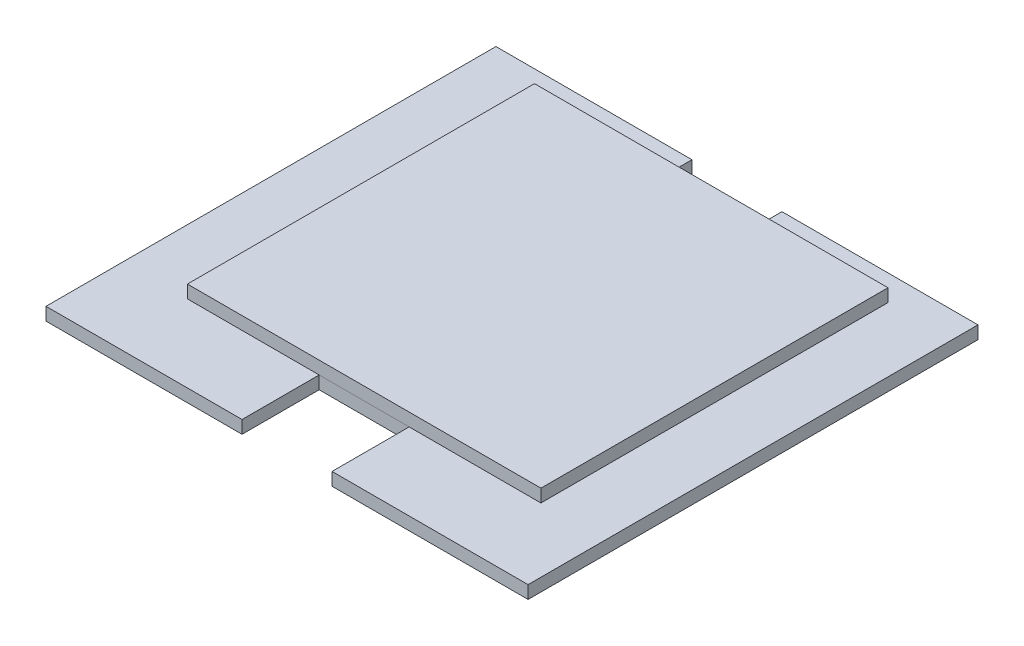
from build123d import *

# Parameters (mm, degrees)
BOSS_EXTRUDE1_DEPTH = 2
SKETCH2_W           = 55
SKETCH2_H           = 54
BOSS_EXTRUDE2_DEPTH = 2


with BuildPart() as part:
    # Sketch1 → Boss-Extrude1 (new body)
    with BuildSketch(Plane(origin=(0, 0, 0), x_dir=(1, 0, 0), z_dir=(0, 1, 0))):
        Polygon((7, 35), (37.5, 35), (37.5, -35), (7, -35), (7, -23), (-7, -23), (-7, -35), (-37.5, -35), (-37.5, 35), (-7, 35), (-7, 31), (7, 31), align=None)
    extrude(amount=BOSS_EXTRUDE1_DEPTH)


with BuildPart() as body_2:
    # Sketch2 → Boss-Extrude2 (new body)
    with BuildSketch(Plane(origin=(0, 2, 0), x_dir=(1, 0, 0), z_dir=(0, 1, 0))):
        with Locations((0, 4)):
            Rectangle(SKETCH2_W, SKETCH2_H)
    extrude(amount=BOSS_EXTRUDE2_DEPTH)


solid = Compound([part.part, body_2.part])
